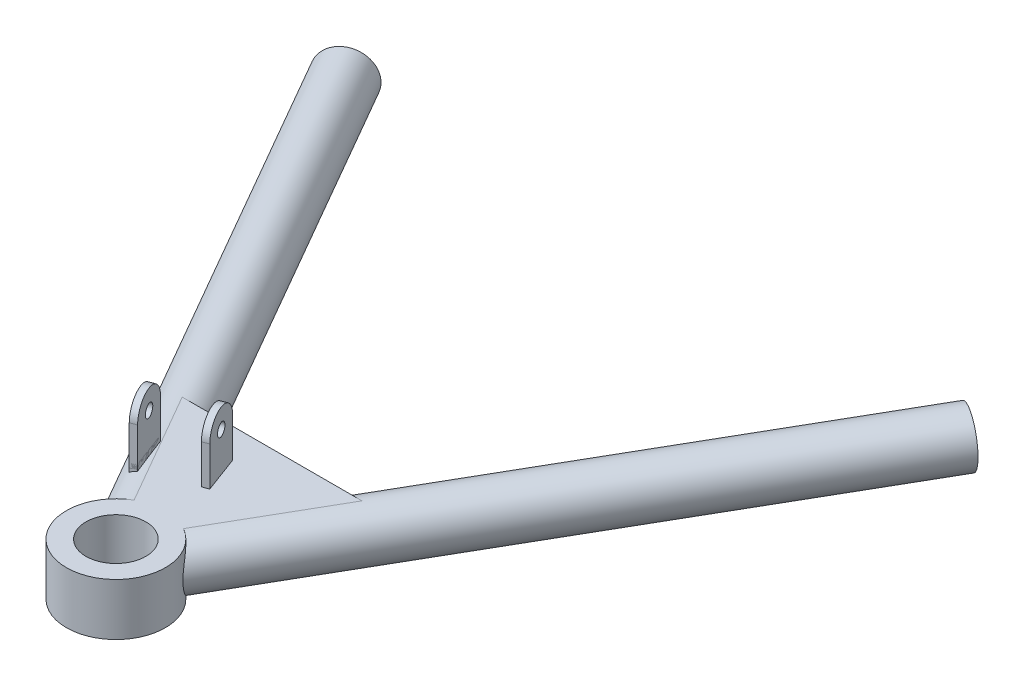
from build123d import *

# Parameters (mm, degrees)
SKETCH1_R                = 19.0062
SKETCH1_R_2              = 11.5062
BOSS_EXTRUDE1_DEPTH      = 10
BOSS_EXTRUDE2_REACH      = 268.113
BOSS_EXTRUDE2_END_RADIUS = 19.0062
SKETCH5_R                = 10
SKETCH5_R_2              = 7
BOSS_EXTRUDE3_REACH      = 338.296
BOSS_EXTRUDE3_END_RADIUS = 19.0062
SKETCH6_R                = 10
SKETCH6_R_2              = 7
BOSS_EXTRUDE7_DEPTH      = 7.5
SKETCH14_R               = 2.413
BOSS_EXTRUDE8_DEPTH      = 12.025
SKETCH14_2_R             = 2.413
CUT_EXTRUDE1_DEPTH       = 9.525
SKETCH15_W               = 15
SKETCH15_H               = 4
BOSS_EXTRUDE9_DEPTH      = 2.5


with BuildPart() as part:
    # Sketch1 → Boss-Extrude1 (new, symmetric)
    with BuildSketch(Plane(origin=(0, 0, 0), x_dir=(1, 0, 0), z_dir=(0, 1, 0))):
        with Locations(Location((0, 0, 0), (0, 0, 270))):
            Circle(SKETCH1_R)
        with Locations(Location((0, 0, 0), (0, 0, 270))):
            Circle(SKETCH1_R_2, mode=Mode.SUBTRACT)
    extrude(amount=BOSS_EXTRUDE1_DEPTH, both=True)

    # Boss-Extrude2: up to this cylinder (the profile starts outside it)
    boss_extrude2_end = Plane(origin=(0, 0, 0), z_dir=(0, -1, 0)) * Cylinder(BOSS_EXTRUDE2_END_RADIUS, 575.2384, mode=Mode.PRIVATE)
    # Sketch5 → Boss-Extrude2 (add, up to the surface)
    with BuildSketch(Plane(origin=(119.67422463, 0, -207.893924576), x_dir=(0.8666626120859299, 0, 0.49889469511350093), z_dir=(0.498894695113501, 0, -0.86666261208593)), mode=Mode.PRIVATE) as boss_extrude2_sk1:
        with Locations(Location((0, 0, 0), (0, 0, 180))):
            Circle(SKETCH5_R)
        with Locations(Location((0, 0, 0), (0, 0, 180))):
            Circle(SKETCH5_R_2, mode=Mode.SUBTRACT)
    boss_extrude2_tool1 = extrude(boss_extrude2_sk1.sketch, amount=-BOSS_EXTRUDE2_REACH, mode=Mode.PRIVATE) - boss_extrude2_end
    add(boss_extrude2_tool1.solids().sort_by_distance((128.095722, 0, -203.046086))[0])

    # Boss-Extrude3: up to this cylinder (the profile starts outside it)
    boss_extrude3_end = Plane(origin=(0, 0, 0), z_dir=(0, -1, 0)) * Cylinder(BOSS_EXTRUDE3_END_RADIUS, 715.6044, mode=Mode.PRIVATE)
    # Sketch6 → Boss-Extrude3 (add, up to the surface)
    with BuildSketch(Plane(origin=(-119.67422463, 0, -207.893924576), x_dir=(-0.8666626120859261, 0, 0.4988946951135074), z_dir=(-0.4988946951135074, 0, -0.8666626120859261)), mode=Mode.PRIVATE) as boss_extrude3_sk1:
        Circle(SKETCH6_R)
        Circle(SKETCH6_R_2, mode=Mode.SUBTRACT)
    boss_extrude3_tool1 = extrude(boss_extrude3_sk1.sketch, amount=-BOSS_EXTRUDE3_REACH, mode=Mode.PRIVATE) - boss_extrude3_end
    add(boss_extrude3_tool1.solids().sort_by_distance((-111.252728, 0, -212.741763))[0])

    # Sketch13 → Boss-Extrude7 (add)
    with BuildSketch(Plane(origin=(0, 10, 0), x_dir=(1, 0, 0), z_dir=(0, 1, 0))):
        with BuildLine():
            Line((9.482092354, 16.471962938), (34.539025094, 60))
            Line((34.539025094, 60), (-34.539025094, 60))
            Line((-34.539025094, 60), (-9.482092354, 16.471962938))
            ThreePointArc((-9.482092354, 16.471962938), (0, 19.0062), (9.482092354, 16.471962938))
        make_face()
    extrude(amount=-BOSS_EXTRUDE7_DEPTH)

    # Sketch14 → Boss-Extrude8 (add, symmetric)
    with BuildSketch(Plane(origin=(1.308996148, 0, -0.488385142), x_dir=(0.3495614575204513, 0, 0.936913436458341), z_dir=(-0.9369134364583411, 0, 0.3495614575204513))):
        with BuildLine():
            Line((-47.003772086, 10), (-47.003772086, 25))
            ThreePointArc((-47.003772086, 25), (-39.503772086, 32.5), (-32.003772086, 25))
            Line((-32.003772086, 25), (-32.003772086, 10))
            Line((-32.003772086, 10), (-47.003772086, 10))
        make_face()
        with Locations((-39.503772086, 25)):
            Circle(SKETCH14_R, mode=Mode.SUBTRACT)
    extrude(amount=BOSS_EXTRUDE8_DEPTH, both=True)

    # Sketch14<2> → Cut-Extrude1 (cut, symmetric)
    with BuildSketch(Plane(origin=(1.308996148, 0, -0.488385142), x_dir=(0.3495614575204513, 0, 0.936913436458341), z_dir=(-0.9369134364583411, 0, 0.3495614575204513))):
        with BuildLine():
            Line((-47.003772086, 10), (-47.003772086, 25))
            ThreePointArc((-47.003772086, 25), (-39.503772086, 32.5), (-32.003772086, 25))
            Line((-32.003772086, 25), (-32.003772086, 10))
            Line((-32.003772086, 10), (-47.003772086, 10))
        make_face()
        with Locations((-39.503772086, 25)):
            Circle(SKETCH14_2_R, mode=Mode.SUBTRACT)
    extrude(amount=CUT_EXTRUDE1_DEPTH, both=True, mode=Mode.SUBTRACT)


with BuildPart() as cut_extrude1_piece_1:
    # of the separate pieces the step leaves, piece 1, a body of its own (cut_extrude1_pieces)
    add(part.part.solids().sort_by_distance((111.007598509, 0, -212.882871527))[0])

    # Sketch15 → Boss-Extrude9 (add)
    with BuildSketch(Plane(origin=(-9.957387925, 0, 3.715091385), x_dir=(0.34956145752045137, 0, 0.936913436458341), z_dir=(-0.936913436458341, 0, 0.34956145752045137))):
        with Locations((-39.503772086, 10)):
            Rectangle(SKETCH15_W, SKETCH15_H)
    extrude(amount=-BOSS_EXTRUDE9_DEPTH)


with BuildPart() as cut_extrude1_piece_2:
    # of the separate pieces the step leaves, piece 2, a body of its own (cut_extrude1_pieces)
    add(part.part.solids().sort_by_distance((-18.802389551, 10, -27.143576344))[0])


solid = Compound([cut_extrude1_piece_1.part, cut_extrude1_piece_2.part])
